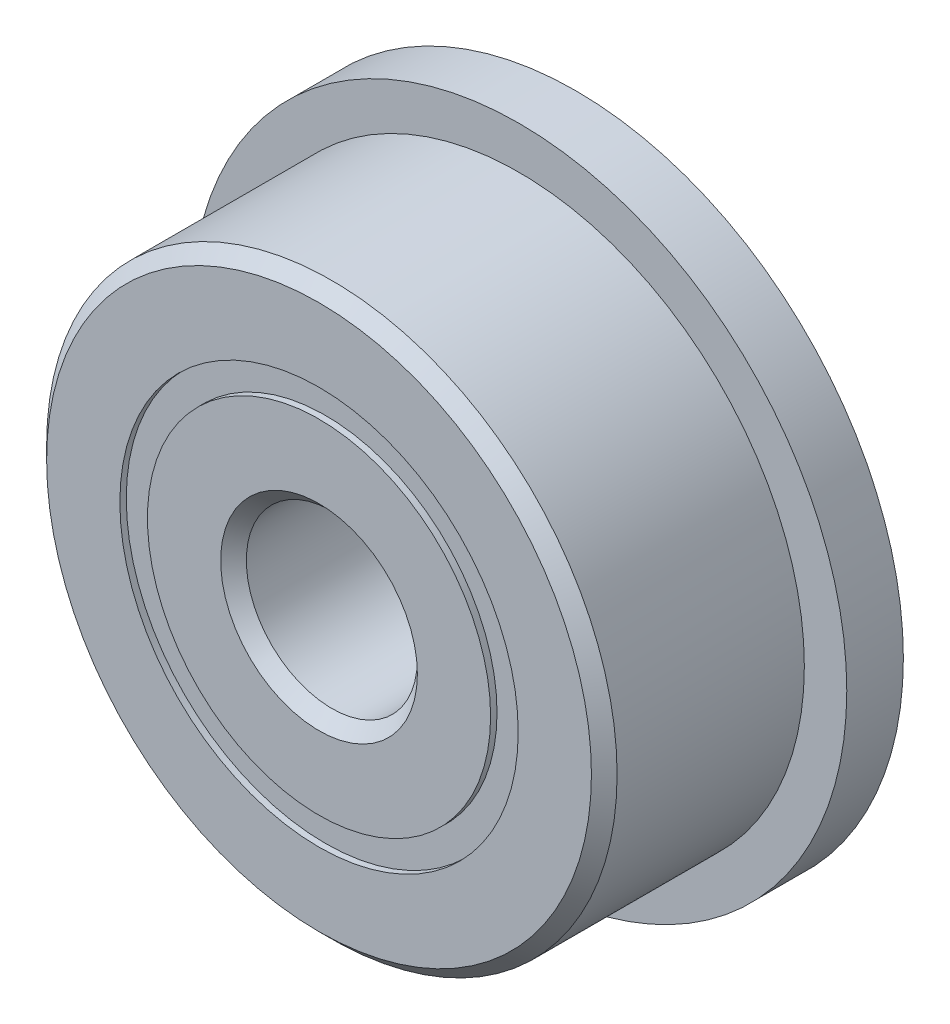
from build123d import *

# Parameters (mm, degrees)
CIRPATTERN1_COUNT = 12
SKETCH5_W         = 0.879852806
SKETCH5_H         = 0.383847032
SKETCH6_W         = 0.7874
SKETCH6_H         = 1.788006484


with BuildPart() as part:
    # Sketch1 → Revolve1 (revolve)
    with BuildSketch(Plane(origin=(0, 0, 0), x_dir=(0, 0, -1), z_dir=(1, 0, 0)), mode=Mode.PRIVATE) as revolve1_sk:
        with BuildLine():
            Line((1.607058, 3.96875), (-1.607058, 3.96875))
            Line((-1.607058, 3.96875), (-1.78562, 3.790188))
            Line((-1.78562, 3.790188), (-1.78562, 2.771293516))
            Line((-1.78562, 2.771293516), (-0.793608889, 2.771293516))
            ThreePointArc((-0.793608889, 2.771293516), (0, 3.395856194), (0.793608889, 2.771293516))
            Line((0.793608889, 2.771293516), (1.78562, 2.771293516))
            Line((1.78562, 2.771293516), (1.78562, 3.790188))
            Line((1.78562, 3.790188), (1.607058, 3.96875))
        make_face()
    revolve(revolve1_sk.sketch.rotate(Axis((0, 0, 1.78562), (0, 0, -1)), 90), axis=Axis((0, 0, 1.78562), (0, 0, -1)))

    # Sketch6 → Revolve6 (revolve)
    with BuildSketch(Plane(origin=(0, 0, 0), x_dir=(0, 0, -1), z_dir=(1, 0, 0)), mode=Mode.PRIVATE) as revolve6_sk:
        with Locations((1.39192, 3.665296758)):
            Rectangle(SKETCH6_W, SKETCH6_H)
    revolve(revolve6_sk.sketch.rotate(Axis((0, 0, -1.78562), (0, 0, 1)), 270), axis=Axis((0, 0, -1.78562), (0, 0, 1)))


with BuildPart() as body_2:
    # Sketch3 → Revolve3 (revolve)
    with BuildSketch(Plane(origin=(0, 0, 0), x_dir=(0, 0, -1), z_dir=(1, 0, 0)), mode=Mode.PRIVATE) as revolve3_sk:
        with BuildLine():
            Line((-1.78562, 2.387446484), (-0.793608889, 2.387446484))
            ThreePointArc((-0.793608889, 2.387446484), (0, 1.762883806), (0.793608889, 2.387446484))
            Line((0.793608889, 2.387446484), (1.78562, 2.387446484))
            Line((1.78562, 2.387446484), (1.78562, 1.368552))
            Line((1.78562, 1.368552), (1.607058, 1.18999))
            Line((1.607058, 1.18999), (-1.607058, 1.18999))
            Line((-1.607058, 1.18999), (-1.78562, 1.368552))
            Line((-1.78562, 1.368552), (-1.78562, 2.387446484))
        make_face()
    revolve(revolve3_sk.sketch.rotate(Axis((0, 0, 1.78562), (0, 0, -1)), 90), axis=Axis((0, 0, 1.78562), (0, 0, -1)))


with BuildPart() as body_3:
    # Sketch4 → Revolve4 (revolve)
    with BuildSketch(Plane(origin=(0, 0, 0), x_dir=(0, 0, -1), z_dir=(1, 0, 0))):
        with BuildLine():
            Line((-0.816486194, 2.57937), (0.816486194, 2.57937))
            ThreePointArc((0.816486194, 2.57937), (0, 3.395856194), (-0.816486194, 2.57937))
        make_face()
    revolve(axis=Axis((0, 2.57937, 0.816486194), (0, 0, -1)))


with BuildPart() as cirpattern1_1:
    # CirPattern1: pattern copy
    add(body_3.part.rotate(Axis((0, 0, 0), (0, 0, 1)), 1 * 360 / CIRPATTERN1_COUNT))


with BuildPart() as cirpattern1_2:
    # CirPattern1: pattern copy
    add(body_3.part.rotate(Axis((0, 0, 0), (0, 0, 1)), 2 * 360 / CIRPATTERN1_COUNT))


with BuildPart() as cirpattern1_3:
    # CirPattern1: pattern copy
    add(body_3.part.rotate(Axis((0, 0, 0), (0, 0, 1)), 3 * 360 / CIRPATTERN1_COUNT))


with BuildPart() as cirpattern1_4:
    # CirPattern1: pattern copy
    add(body_3.part.rotate(Axis((0, 0, 0), (0, 0, 1)), 4 * 360 / CIRPATTERN1_COUNT))


with BuildPart() as cirpattern1_5:
    # CirPattern1: pattern copy
    add(body_3.part.rotate(Axis((0, 0, 0), (0, 0, 1)), 5 * 360 / CIRPATTERN1_COUNT))


with BuildPart() as cirpattern1_6:
    # CirPattern1: pattern copy
    add(body_3.part.rotate(Axis((0, 0, 0), (0, 0, 1)), 6 * 360 / CIRPATTERN1_COUNT))


with BuildPart() as cirpattern1_7:
    # CirPattern1: pattern copy
    add(body_3.part.rotate(Axis((0, 0, 0), (0, 0, 1)), 7 * 360 / CIRPATTERN1_COUNT))


with BuildPart() as cirpattern1_8:
    # CirPattern1: pattern copy
    add(body_3.part.rotate(Axis((0, 0, 0), (0, 0, 1)), 8 * 360 / CIRPATTERN1_COUNT))


with BuildPart() as cirpattern1_9:
    # CirPattern1: pattern copy
    add(body_3.part.rotate(Axis((0, 0, 0), (0, 0, 1)), 9 * 360 / CIRPATTERN1_COUNT))


with BuildPart() as cirpattern1_10:
    # CirPattern1: pattern copy
    add(body_3.part.rotate(Axis((0, 0, 0), (0, 0, 1)), 10 * 360 / CIRPATTERN1_COUNT))


with BuildPart() as cirpattern1_11:
    # CirPattern1: pattern copy
    add(body_3.part.rotate(Axis((0, 0, 0), (0, 0, 1)), 11 * 360 / CIRPATTERN1_COUNT))


with BuildPart() as body_15:
    # Sketch5 → Revolve5 (revolve)
    with BuildSketch(Plane(origin=(0, 0, 0), x_dir=(0, 0, -1), z_dir=(1, 0, 0)), mode=Mode.PRIVATE) as revolve5_sk:
        with Locations((-1.256412597, 2.57937)):
            Rectangle(SKETCH5_W, SKETCH5_H)
        with Locations((1.256412597, 2.57937)):
            Rectangle(SKETCH5_W, SKETCH5_H)
    revolve(revolve5_sk.sketch.rotate(Axis((0, 0, 1.78562), (0, 0, -1)), 90), axis=Axis((0, 0, 1.78562), (0, 0, -1)))


solid = Compound([part.part, body_2.part, body_3.part, cirpattern1_1.part, cirpattern1_2.part, cirpattern1_3.part, cirpattern1_4.part, cirpattern1_5.part, cirpattern1_6.part, cirpattern1_7.part, cirpattern1_8.part, cirpattern1_9.part, cirpattern1_10.part, cirpattern1_11.part, body_15.part])
